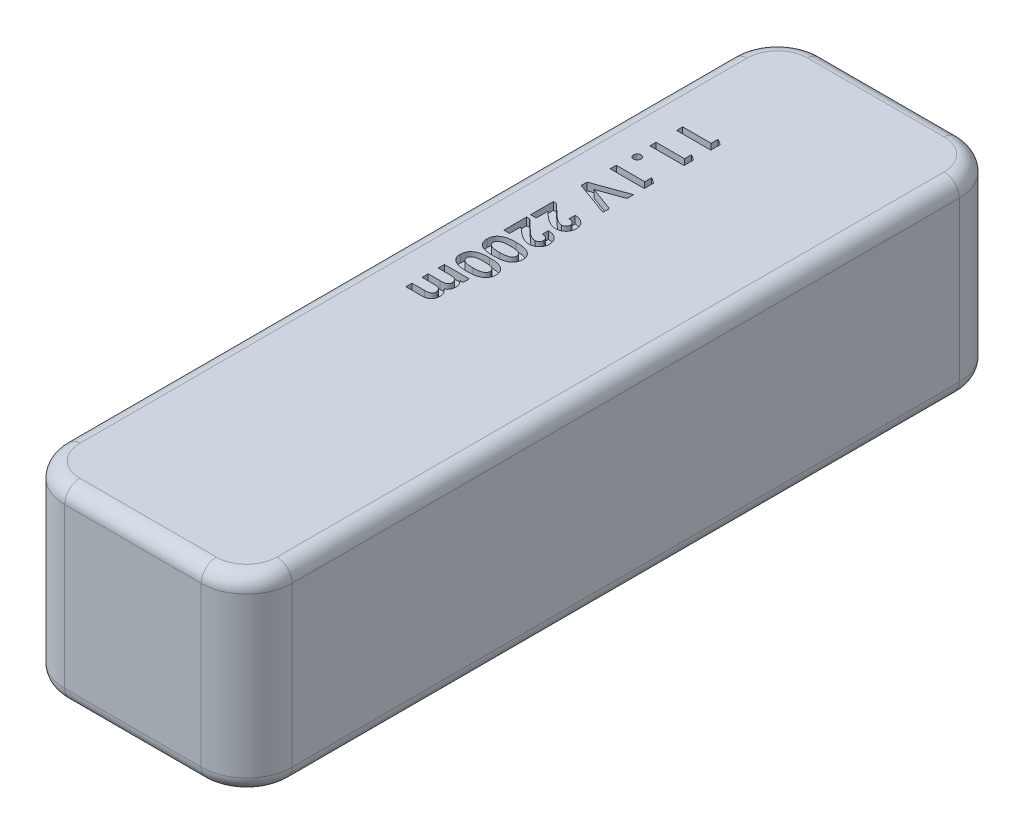
from build123d import *

# Parameters (mm, degrees)
SKETCH_1_W          = 30
SKETCH_1_H          = 100
EXTRUDE_1_DEPTH     = 25
FILLET_2_R          = 6
FILLET_3_R          = 2
CUT_EXTRUDE_1_DEPTH = 1


with BuildPart() as part:
    # 草圖1 → 填料-伸長1 (new body)
    with BuildSketch(Plane(origin=(0, 0, 0), x_dir=(1, 0, 0), z_dir=(0, 1, 0))):
        Rectangle(SKETCH_1_W, SKETCH_1_H)
    extrude(amount=EXTRUDE_1_DEPTH)

    # 圓角2
    fillet_2_edges = [part.edges().sort_by_distance(p)[0] for p in [
        (15, 12.5, 50),
        (-15, 12.5, 50),
        (-15, 12.5, -50),
        (15, 12.5, -50),
    ]]
    fillet(fillet_2_edges, radius=FILLET_2_R)

    # 圓角3
    fillet_3_edges = [part.edges().sort_by_distance(p)[0] for p in [
        (-15, 0, 0),
        (-15, 25, 0),
        (15, 0, 0),
        (0, 0, 50),
        (0, 0, -50),
        (13.242640687, 0, 48.242640687),
        (-13.242640687, 0, 48.242640687),
        (13.242640687, 0, -48.242640687),
        (-13.242640687, 0, -48.242640687),
        (0, 25, -50),
        (15, 25, 0),
        (0, 25, 50),
        (13.242640687, 25, 48.242640687),
        (-13.242640687, 25, 48.242640687),
        (13.242640687, 25, -48.242640687),
        (-13.242640687, 25, -48.242640687),
    ]]
    fillet(fillet_3_edges, radius=FILLET_3_R)

    # 草圖2 → 除料-伸長1 (cut)
    # profile 1 of 10: a face of its own
    with BuildSketch(Plane(origin=(0, 25, 0), x_dir=(1, 0, 0), z_dir=(0, 1, 0))):
        Polygon((-4.881593101, 32.34579671), (-4.881593101, 31.097299114), (-9.381593101, 31.097299114), (-9.381593101, 31.904991422), (-5.631593101, 31.904991422), (-5.631593101, 32.828068345), align=None)
    # profile 2 of 10: a face of its own
    with BuildSketch(Plane(origin=(0, 25, 0), x_dir=(1, 0, 0), z_dir=(0, 1, 0))):
        Polygon((-4.881593101, 28.826565941), (-4.881593101, 27.578068345), (-9.381593101, 27.578068345), (-9.381593101, 28.385760652), (-5.631593101, 28.385760652), (-5.631593101, 29.308837576), align=None)
    # profile 3 of 10: a face of its own
    with BuildSketch(Plane(origin=(0, 25, 0), x_dir=(1, 0, 0), z_dir=(0, 1, 0))):
        with BuildLine():
            add(Edge.make_bspline(
                [(-8.458516178, 25.472299114), (-8.460290027, 25.439685763), (-8.463782428, 25.375475708), (-8.490321002, 25.282578442), (-8.536972452, 25.198249578), (-8.598912112, 25.123381261), (-8.672626709, 25.059811488), (-8.757618272, 25.015358455), (-8.849706295, 24.986603997), (-8.914126505, 24.983502103), (-8.947097909, 24.981914499)],
                knots=[0, 0, 0, 0, 1.016476041, 2.001265769, 2.982571086, 4.001334304, 5.018889842, 5.99575474, 6.974191785, 8, 8, 8, 8], degree=3))
            add(Edge.make_bspline(
                [(-8.947097909, 24.981914499), (-8.980074401, 24.983491697), (-9.044504551, 24.986573261), (-9.136776315, 25.015555014), (-9.222457473, 25.059740673), (-9.296967241, 25.123386569), (-9.360069217, 25.197938011), (-9.406279845, 25.282771986), (-9.434311369, 25.375299105), (-9.437611444, 25.4396547), (-9.439285409, 25.472299114)],
                knots=[0, 0, 0, 0, 1.022731703, 1.998234309, 2.980426153, 4.002090265, 5.023754376, 6.00211665, 6.986572482, 8, 8, 8, 8], degree=3))
            add(Edge.make_bspline(
                [(-9.439285409, 25.472299114), (-9.43759772, 25.504935795), (-9.43427059, 25.569276144), (-9.406513808, 25.66165966), (-9.359757051, 25.745871914), (-9.297043312, 25.82040463), (-9.222192419, 25.883767449), (-9.137044971, 25.929246108), (-9.044469649, 25.957960396), (-8.980062585, 25.96108467), (-8.947097909, 25.962683729)],
                knots=[0, 0, 0, 0, 1.013910294, 1.9988351, 2.969460266, 3.991611077, 5.013761889, 6.000813773, 6.976781088, 8, 8, 8, 8], degree=3))
            add(Edge.make_bspline(
                [(-8.947097909, 25.962683729), (-8.914138526, 25.961074126), (-8.849741804, 25.957929249), (-8.757346522, 25.929443228), (-8.672893202, 25.883699093), (-8.598835882, 25.820409708), (-8.537282181, 25.745561944), (-8.490090245, 25.661852124), (-8.463823508, 25.569099452), (-8.460303864, 25.504904695), (-8.458516178, 25.472299114)],
                knots=[0, 0, 0, 0, 1.02629359, 2.005193596, 2.986963232, 4.00500024, 5.0242455, 5.997787305, 6.983042999, 8, 8, 8, 8], degree=3))
        make_face()
    # profile 4 of 10: a face of its own
    with BuildSketch(Plane(origin=(0, 25, 0), x_dir=(1, 0, 0), z_dir=(0, 1, 0))):
        Polygon((-4.881593101, 23.576565941), (-4.881593101, 22.328068345), (-9.381593101, 22.328068345), (-9.381593101, 23.135760652), (-5.631593101, 23.135760652), (-5.631593101, 24.058837576), align=None)
    # profile 5 of 10: a face of its own
    with BuildSketch(Plane(origin=(0, 25, 0), x_dir=(1, 0, 0), z_dir=(0, 1, 0))):
        Polygon((-4.881593101, 20.914606806), (-4.881593101, 20.051926518), (-8.078107524, 18.895376037), (-4.881593101, 17.736121229), (-4.881593101, 16.876145268), (-9.381593101, 18.507755845), (-9.381593101, 19.285700556), align=None)
    # profile 6 of 10: a face of its own
    with BuildSketch(Plane(origin=(0, 25, 0), x_dir=(1, 0, 0), z_dir=(0, 1, 0))):
        with BuildLine():
            Line((-6.381593101, 13.904991422), (-6.381593101, 14.712683729))
            add(Edge.make_bspline(
                [(-6.381593101, 14.712683729), (-6.320495451, 14.70919543), (-6.201114311, 14.702379503), (-6.027709383, 14.675267467), (-5.863860794, 14.63893827), (-5.710141705, 14.590452133), (-5.566607972, 14.52952613), (-5.432770281, 14.457728043), (-5.30933329, 14.373223595), (-5.196892282, 14.277811317), (-5.096020417, 14.173111049), (-5.006581084, 14.06129647), (-4.932777997, 13.940657226), (-4.872044889, 13.813397494), (-4.823521959, 13.679538944), (-4.791080453, 13.537815065), (-4.769110747, 13.389452977), (-4.76718831, 13.287887114), (-4.766208486, 13.236121229)],
                knots=[0, 0, 0, 0, 1.199038563, 2.342849363, 3.436047546, 4.486744587, 5.497670872, 6.488682221, 7.459191391, 8.424610317, 9.374430501, 10.305433194, 11.225809216, 12.140057399, 13.06607119, 14.010487599, 14.985989317, 16, 16, 16, 16], degree=3))
            add(Edge.make_bspline(
                [(-4.766208486, 13.236121229), (-4.76819439, 13.172580735), (-4.77207134, 13.048534799), (-4.80504415, 12.868262788), (-4.860519644, 12.699740487), (-4.937259728, 12.542962684), (-5.035201605, 12.399811349), (-5.15300391, 12.271218998), (-5.290256632, 12.15798881), (-5.44416051, 12.062288064), (-5.607379676, 11.984072773), (-5.775467911, 11.928138853), (-5.944922424, 11.891617718), (-6.058997159, 11.887704617), (-6.11566762, 11.885760652)],
                knots=[0, 0, 0, 0, 1.075208937, 2.099059817, 3.090102131, 4.070747506, 5.044426497, 6.016695572, 7.013986309, 8.047248753, 9.078128699, 10.07077592, 11.041593041, 12, 12, 12, 12], degree=3))
            add(Edge.make_bspline(
                [(-6.11566762, 11.885760652), (-6.14994726, 11.886515621), (-6.218943707, 11.888035187), (-6.323352265, 11.898600932), (-6.429704592, 11.914451631), (-6.537909481, 11.938350648), (-6.647997344, 11.968154583), (-6.760297318, 12.004311449), (-6.874173953, 12.04765811), (-6.990903983, 12.097478354), (-7.110886145, 12.156890061), (-7.235837508, 12.226165322), (-7.366126301, 12.306739509), (-7.500800447, 12.39948731), (-7.642779059, 12.50064453), (-7.788406695, 12.615008733), (-7.940068492, 12.739232191), (-8.041380519, 12.827493552), (-8.093432043, 12.872839979)],
                knots=[0, 0, 0, 0, 0.728291422, 1.465870735, 2.227967504, 3.011895603, 3.818808047, 4.650669213, 5.517493715, 6.406970765, 7.346374078, 8.360901659, 9.441709605, 10.599840149, 11.834858619, 13.145178554, 14.533265854, 16, 16, 16, 16], degree=3))
            Line((-8.093432043, 12.872839979), (-8.631593101, 13.342491422))
            Line((-8.631593101, 13.342491422), (-8.631593101, 11.828068345))
            Line((-8.631593101, 11.828068345), (-9.381593101, 11.828068345))
            Line((-9.381593101, 11.828068345), (-9.381593101, 14.828068345))
            Line((-9.381593101, 14.828068345), (-8.972338293, 14.828068345))
            Line((-8.972338293, 14.828068345), (-7.554369543, 13.495736614))
            add(Edge.make_bspline(
                [(-7.554369543, 13.495736614), (-7.513006955, 13.457162187), (-7.432899887, 13.38245496), (-7.315254135, 13.276154276), (-7.203611124, 13.179961547), (-7.096782082, 13.095871407), (-6.998232109, 13.019470915), (-6.904990784, 12.954166762), (-6.817901043, 12.899361466), (-6.712886026, 12.839862544), (-6.58763693, 12.783358127), (-6.443344837, 12.731511905), (-6.305434827, 12.699908044), (-6.2155697, 12.695545712), (-6.172458486, 12.69345296)],
                knots=[0, 0, 0, 0, 1.246127091, 2.413378631, 3.493388633, 4.492180848, 5.408488754, 6.240484944, 6.999099869, 7.674939598, 8.898438119, 10.020720584, 11.050475521, 12, 12, 12, 12], degree=3))
            add(Edge.make_bspline(
                [(-6.172458486, 12.69345296), (-6.130739304, 12.694993227), (-6.0499017, 12.697977741), (-5.935245184, 12.73159265), (-5.830647635, 12.78188886), (-5.740873761, 12.85490942), (-5.66645957, 12.943043369), (-5.611929749, 13.045469663), (-5.579879988, 13.160307676), (-5.575931848, 13.240725287), (-5.573900793, 13.282094787)],
                knots=[0, 0, 0, 0, 1.061596218, 2.057012874, 3.024113775, 4.006148568, 4.986025304, 5.949989669, 6.945406325, 8, 8, 8, 8], degree=3))
            add(Edge.make_bspline(
                [(-5.573900793, 13.282094787), (-5.574656562, 13.303462583), (-5.576144413, 13.345528521), (-5.586048637, 13.407362162), (-5.603503797, 13.466201314), (-5.626891255, 13.522700889), (-5.657891498, 13.57625791), (-5.696104237, 13.626737287), (-5.740558399, 13.674670886), (-5.791114982, 13.719838863), (-5.847536143, 13.760947619), (-5.909306591, 13.797460265), (-5.976387983, 13.827650145), (-6.047894741, 13.854230413), (-6.124594908, 13.874730388), (-6.20602944, 13.889656912), (-6.292065855, 13.901004552), (-6.351207799, 13.903638289), (-6.381593101, 13.904991422)],
                knots=[0, 0, 0, 0, 0.903469896, 1.778625579, 2.63899355, 3.493148037, 4.358286772, 5.247621495, 6.164656832, 7.118446693, 8.109501108, 9.111810964, 10.146451449, 11.215617525, 12.33435995, 13.498009769, 14.714554818, 16, 16, 16, 16], degree=3))
        make_face()
    # profile 7 of 10: a face of its own
    with BuildSketch(Plane(origin=(0, 25, 0), x_dir=(1, 0, 0), z_dir=(0, 1, 0))):
        with BuildLine():
            Line((-6.381593101, 10.385760652), (-6.381593101, 11.19345296))
            add(Edge.make_bspline(
                [(-6.381593101, 11.19345296), (-6.320495451, 11.189964661), (-6.201114311, 11.183148734), (-6.027709383, 11.156036698), (-5.863860794, 11.119707501), (-5.710141705, 11.071221364), (-5.566607972, 11.010295361), (-5.432770281, 10.938497274), (-5.30933329, 10.853992825), (-5.196892282, 10.758580548), (-5.096020417, 10.65388028), (-5.006581084, 10.542065701), (-4.932777997, 10.421426457), (-4.872044889, 10.294166725), (-4.823521959, 10.160308175), (-4.791080453, 10.018584296), (-4.769110747, 9.870222208), (-4.76718831, 9.768656345), (-4.766208486, 9.71689046)],
                knots=[0, 0, 0, 0, 1.199038563, 2.342849363, 3.436047546, 4.486744587, 5.497670872, 6.488682221, 7.459191391, 8.424610317, 9.374430501, 10.305433194, 11.225809216, 12.140057399, 13.06607119, 14.010487599, 14.985989317, 16, 16, 16, 16], degree=3))
            add(Edge.make_bspline(
                [(-4.766208486, 9.71689046), (-4.76819439, 9.653349966), (-4.77207134, 9.52930403), (-4.80504415, 9.349032019), (-4.860519644, 9.180509718), (-4.937259728, 9.023731915), (-5.035201605, 8.880580579), (-5.15300391, 8.751988228), (-5.290256632, 8.638758041), (-5.44416051, 8.543057295), (-5.607379676, 8.464842003), (-5.775467911, 8.408908084), (-5.944922424, 8.372386949), (-6.058997159, 8.368473848), (-6.11566762, 8.366529883)],
                knots=[0, 0, 0, 0, 1.075208937, 2.099059817, 3.090102131, 4.070747506, 5.044426497, 6.016695572, 7.013986309, 8.047248753, 9.078128699, 10.07077592, 11.041593041, 12, 12, 12, 12], degree=3))
            add(Edge.make_bspline(
                [(-6.11566762, 8.366529883), (-6.14994726, 8.367284852), (-6.218943707, 8.368804418), (-6.323352265, 8.379370163), (-6.429704592, 8.395220861), (-6.537909481, 8.419119879), (-6.647997344, 8.448923814), (-6.760297318, 8.48508068), (-6.874173953, 8.528427341), (-6.990903983, 8.578247585), (-7.110886145, 8.637659292), (-7.235837508, 8.706934552), (-7.366126301, 8.787508739), (-7.500800447, 8.880256541), (-7.642779059, 8.981413761), (-7.788406695, 9.095777963), (-7.940068492, 9.220001421), (-8.041380519, 9.308262783), (-8.093432043, 9.35360921)],
                knots=[0, 0, 0, 0, 0.728291422, 1.465870735, 2.227967504, 3.011895603, 3.818808047, 4.650669213, 5.517493715, 6.406970765, 7.346374078, 8.360901659, 9.441709605, 10.599840149, 11.834858619, 13.145178554, 14.533265854, 16, 16, 16, 16], degree=3))
            Line((-8.093432043, 9.35360921), (-8.631593101, 9.823260652))
            Line((-8.631593101, 9.823260652), (-8.631593101, 8.308837576))
            Line((-8.631593101, 8.308837576), (-9.381593101, 8.308837576))
            Line((-9.381593101, 8.308837576), (-9.381593101, 11.308837576))
            Line((-9.381593101, 11.308837576), (-8.972338293, 11.308837576))
            Line((-8.972338293, 11.308837576), (-7.554369543, 9.976505845))
            add(Edge.make_bspline(
                [(-7.554369543, 9.976505845), (-7.513006955, 9.937931417), (-7.432899887, 9.863224191), (-7.315254135, 9.756923507), (-7.203611124, 9.660730777), (-7.096782082, 9.576640638), (-6.998232109, 9.500240145), (-6.904990784, 9.434935992), (-6.817901043, 9.380130697), (-6.712886026, 9.320631775), (-6.58763693, 9.264127358), (-6.443344837, 9.212281136), (-6.305434827, 9.180677275), (-6.2155697, 9.176314943), (-6.172458486, 9.174222191)],
                knots=[0, 0, 0, 0, 1.246127091, 2.413378631, 3.493388633, 4.492180848, 5.408488754, 6.240484944, 6.999099869, 7.674939598, 8.898438119, 10.020720584, 11.050475521, 12, 12, 12, 12], degree=3))
            add(Edge.make_bspline(
                [(-6.172458486, 9.174222191), (-6.130739304, 9.175762458), (-6.0499017, 9.178746972), (-5.935245184, 9.212361881), (-5.830647635, 9.26265809), (-5.740873761, 9.335678651), (-5.66645957, 9.4238126), (-5.611929749, 9.526238894), (-5.579879988, 9.641076907), (-5.575931848, 9.721494517), (-5.573900793, 9.762864018)],
                knots=[0, 0, 0, 0, 1.061596218, 2.057012874, 3.024113775, 4.006148568, 4.986025304, 5.949989669, 6.945406325, 8, 8, 8, 8], degree=3))
            add(Edge.make_bspline(
                [(-5.573900793, 9.762864018), (-5.574656562, 9.784231814), (-5.576144413, 9.826297752), (-5.586048637, 9.888131393), (-5.603503797, 9.946970545), (-5.626891255, 10.00347012), (-5.657891498, 10.05702714), (-5.696104237, 10.107506518), (-5.740558399, 10.155440116), (-5.791114982, 10.200608094), (-5.847536143, 10.241716849), (-5.909306591, 10.278229496), (-5.976387983, 10.308419376), (-6.047894741, 10.334999644), (-6.124594908, 10.355499618), (-6.20602944, 10.370426143), (-6.292065855, 10.381773783), (-6.351207799, 10.38440752), (-6.381593101, 10.385760652)],
                knots=[0, 0, 0, 0, 0.903469896, 1.778625579, 2.63899355, 3.493148037, 4.358286772, 5.247621495, 6.164656832, 7.118446693, 8.109501108, 9.111810964, 10.146451449, 11.215617525, 12.33435995, 13.498009769, 14.714554818, 16, 16, 16, 16], degree=3))
        make_face()
    # profile 8 of 10: a face of its own
    with BuildSketch(Plane(origin=(0, 25, 0), x_dir=(1, 0, 0), z_dir=(0, 1, 0))):
        with BuildLine():
            add(Edge.make_bspline(
                [(-4.766208486, 6.216589979), (-4.766788798, 6.177494279), (-4.767929846, 6.100621687), (-4.780290965, 5.987403518), (-4.798959704, 5.87834047), (-4.825015449, 5.773018224), (-4.859429757, 5.672150026), (-4.900975384, 5.574922557), (-4.950645655, 5.482153472), (-5.007720131, 5.393628179), (-5.071551312, 5.308934387), (-5.145334331, 5.230889691), (-5.225800908, 5.156473256), (-5.314279279, 5.086919023), (-5.41137252, 5.023005723), (-5.515794379, 4.963540277), (-5.62852776, 4.909289522), (-5.749687562, 4.859535777), (-5.881110174, 4.815026235), (-6.024317747, 4.777641755), (-6.179207628, 4.745140774), (-6.346586743, 4.719545338), (-6.526060261, 4.698596079), (-6.717964021, 4.684908066), (-6.921760986, 4.67538574), (-7.061569052, 4.674617089), (-7.133395986, 4.674222191)],
                knots=[0, 0, 0, 0, 0.879087513, 1.728520926, 2.558587148, 3.366762743, 4.166157112, 4.95337177, 5.74258602, 6.530032775, 7.320866164, 8.124307838, 8.942260106, 9.784645725, 10.652593514, 11.554662219, 12.485739241, 13.464770064, 14.499274465, 15.604285219, 16.792026686, 18.057713884, 19.411711354, 20.855437135, 22.384468668, 24, 24, 24, 24], degree=3))
            add(Edge.make_bspline(
                [(-7.133395986, 4.674222191), (-7.20612111, 4.674651959), (-7.347424721, 4.67548699), (-7.553091826, 4.684483926), (-7.746367691, 4.699976951), (-7.927232053, 4.719945864), (-8.095590307, 4.747296495), (-8.251875317, 4.779332154), (-8.396040809, 4.817386426), (-8.527727037, 4.863377394), (-8.649174119, 4.912706543), (-8.761294888, 4.967487721), (-8.866103642, 5.024424623), (-8.962139777, 5.086968697), (-9.049614423, 5.153790716), (-9.129331214, 5.223841642), (-9.200192493, 5.298614165), (-9.263661596, 5.376990059), (-9.319217966, 5.460873825), (-9.366948483, 5.549896484), (-9.40639327, 5.644658731), (-9.440392244, 5.74378201), (-9.464852859, 5.849029706), (-9.484245569, 5.95877676), (-9.494966643, 6.074248874), (-9.496296357, 6.152867459), (-9.496977717, 6.193152479)],
                knots=[0, 0, 0, 0, 1.643682949, 3.193646483, 4.651618242, 6.025629174, 7.305184366, 8.505292942, 9.630500342, 10.672179876, 11.655924581, 12.591484594, 13.491256898, 14.350247848, 15.17884557, 15.977481787, 16.746098769, 17.504475725, 18.254166354, 19.016819136, 19.783753977, 20.571954997, 21.382401421, 22.223156612, 23.089526058, 24, 24, 24, 24], degree=3))
            add(Edge.make_bspline(
                [(-9.496977717, 6.193152479), (-9.496280281, 6.233435621), (-9.494914015, 6.312349702), (-9.4843578, 6.428145196), (-9.464607146, 6.538721675), (-9.440547467, 6.644948852), (-9.406209942, 6.745893816), (-9.36613199, 6.842294027), (-9.318128857, 6.93366956), (-9.262818973, 7.020077981), (-9.199380482, 7.101206384), (-9.128507032, 7.178320291), (-9.050374158, 7.251247813), (-8.964107846, 7.318879941), (-8.870859236, 7.382324031), (-8.769563656, 7.440919127), (-8.660368182, 7.494627471), (-8.543122149, 7.545139221), (-8.41529514, 7.588995527), (-8.275771369, 7.628158662), (-8.123233913, 7.659702223), (-7.958255942, 7.687331603), (-7.780259309, 7.705882988), (-7.590065086, 7.721749042), (-7.387086369, 7.730626224), (-7.247586564, 7.731476649), (-7.175763774, 7.731914499)],
                knots=[0, 0, 0, 0, 0.917197984, 1.796777363, 2.643741708, 3.473481078, 4.273990801, 5.068160217, 5.848535553, 6.620952589, 7.401027954, 8.190319769, 9.003592045, 9.831693788, 10.683727512, 11.569696396, 12.49373307, 13.453184301, 14.474457586, 15.568383184, 16.750575061, 18.019320986, 19.375517054, 20.823796471, 22.364701649, 24, 24, 24, 24], degree=3))
            add(Edge.make_bspline(
                [(-7.175763774, 7.731914499), (-7.075971932, 7.731130909), (-6.883422288, 7.729618963), (-6.605204796, 7.710949723), (-6.348231505, 7.682708242), (-6.112191918, 7.644047824), (-5.897548039, 7.591976454), (-5.704361524, 7.528073607), (-5.530720073, 7.454749373), (-5.427837169, 7.392367054), (-5.378287813, 7.362323152)],
                knots=[0, 0, 0, 0, 1.288526675, 2.486228817, 3.599112392, 4.626206381, 5.5730174, 6.447949553, 7.252518174, 8, 8, 8, 8], degree=3))
            add(Edge.make_bspline(
                [(-5.378287813, 7.362323152), (-5.329611889, 7.327382553), (-5.234440868, 7.259066796), (-5.109499106, 7.139614784), (-5.002642794, 7.011279151), (-4.916290184, 6.871423954), (-4.848192509, 6.722261062), (-4.800095888, 6.562509836), (-4.772072555, 6.392760211), (-4.768192365, 6.276190311), (-4.766208486, 6.216589979)],
                knots=[0, 0, 0, 0, 1.058512271, 2.069600068, 3.047294572, 4.004278952, 4.967380941, 5.939006123, 6.946246673, 8, 8, 8, 8], degree=3))
        make_face()
        with BuildLine():
            add(Edge.make_bspline(
                [(-5.573900793, 6.196758249), (-5.575588814, 6.232094538), (-5.57889823, 6.301372422), (-5.606519859, 6.401744975), (-5.650111083, 6.495968069), (-5.701492553, 6.568095182), (-5.751621328, 6.621838244), (-5.795593533, 6.660789224), (-5.847022527, 6.695673803), (-5.903685322, 6.729332622), (-5.967141319, 6.759279949), (-6.035790001, 6.789058029), (-6.111923222, 6.81331859), (-6.194106136, 6.837211537), (-6.284655676, 6.858100135), (-6.384283959, 6.87573258), (-6.493740138, 6.890937462), (-6.612758879, 6.90377619), (-6.741814048, 6.911938778), (-6.880605172, 6.919838061), (-7.029419481, 6.922713696), (-7.131893992, 6.923708698), (-7.184778197, 6.924222191)],
                knots=[0, 0, 0, 0, 1.076821401, 2.111141558, 3.153197101, 4.23200803, 4.796476379, 5.394298193, 6.020090776, 6.690078086, 7.403703365, 8.159894791, 8.971856079, 9.83973388, 10.771758647, 11.806038152, 12.926526118, 14.143777411, 15.458313878, 16.872423957, 18.385946227, 20, 20, 20, 20], degree=3))
            add(Edge.make_bspline(
                [(-7.184778197, 6.924222191), (-7.253294021, 6.923399751), (-7.384678194, 6.921822662), (-7.573606305, 6.913530856), (-7.745570261, 6.897006449), (-7.901630306, 6.876185387), (-8.041194281, 6.84782165), (-8.16430551, 6.812504718), (-8.271875454, 6.77334037), (-8.362322179, 6.724235693), (-8.439672693, 6.671624334), (-8.506584755, 6.615470002), (-8.562323316, 6.554793308), (-8.609644243, 6.49140791), (-8.644782799, 6.422963205), (-8.670399938, 6.350862677), (-8.686019315, 6.274946272), (-8.688190417, 6.222971586), (-8.689285409, 6.196758249)],
                knots=[0, 0, 0, 0, 1.772047989, 3.398033405, 4.888860297, 6.238411839, 7.468309579, 8.567754056, 9.549141588, 10.421774021, 11.221426488, 11.965694757, 12.675067502, 13.348095901, 14.005005053, 14.656328889, 15.322321954, 16, 16, 16, 16], degree=3))
            add(Edge.make_bspline(
                [(-8.689285409, 6.196758249), (-8.688537023, 6.171443494), (-8.687071776, 6.121880353), (-8.672031213, 6.049606193), (-8.647578524, 5.981258612), (-8.612988479, 5.917043972), (-8.569001944, 5.856732587), (-8.515425624, 5.800619221), (-8.451725488, 5.74912707), (-8.404450566, 5.71912751), (-8.380090697, 5.703669306)],
                knots=[0, 0, 0, 0, 0.992283464, 1.942767638, 2.88273346, 3.832339453, 4.79467288, 5.803907806, 6.868395428, 8, 8, 8, 8], degree=3))
            add(Edge.make_bspline(
                [(-8.380090697, 5.703669306), (-8.346804828, 5.685464255), (-8.277007059, 5.647289739), (-8.159202507, 5.603226153), (-8.026505781, 5.565636537), (-7.87784395, 5.53550368), (-7.713813514, 5.511636434), (-7.534292561, 5.49338992), (-7.339023767, 5.484121902), (-7.203716803, 5.482669389), (-7.133395986, 5.481914499)],
                knots=[0, 0, 0, 0, 0.710996797, 1.490902623, 2.352723643, 3.296875318, 4.334065587, 5.461510359, 6.680713396, 8, 8, 8, 8], degree=3))
            add(Edge.make_bspline(
                [(-7.133395986, 5.481914499), (-7.062466932, 5.4822113), (-6.925940611, 5.482782592), (-6.729941025, 5.49326416), (-6.550927906, 5.507860522), (-6.389301033, 5.529210858), (-6.244667668, 5.556681724), (-6.117038479, 5.59054037), (-6.006158101, 5.630455014), (-5.912149139, 5.677795889), (-5.832226133, 5.730207229), (-5.763753097, 5.78591484), (-5.704803154, 5.845015057), (-5.657021722, 5.908144656), (-5.618938702, 5.974882344), (-5.592985931, 6.045588198), (-5.577020658, 6.120027007), (-5.574954785, 6.170835942), (-5.573900793, 6.196758249)],
                knots=[0, 0, 0, 0, 1.793903324, 3.452957663, 4.963427329, 6.336122014, 7.574844885, 8.684777121, 9.673127442, 10.55010789, 11.340650774, 12.086136756, 12.779466299, 13.446812155, 14.083183996, 14.715685896, 15.34475337, 16, 16, 16, 16], degree=3))
        make_face(mode=Mode.SUBTRACT)
    # profile 9 of 10: a face of its own
    with BuildSketch(Plane(origin=(0, 25, 0), x_dir=(1, 0, 0), z_dir=(0, 1, 0))):
        with BuildLine():
            add(Edge.make_bspline(
                [(-4.766208486, 2.69735921), (-4.766788798, 2.65826351), (-4.767929846, 2.581390918), (-4.780290965, 2.468172749), (-4.798959704, 2.359109701), (-4.825015449, 2.253787454), (-4.859429757, 2.152919257), (-4.900975384, 2.055691788), (-4.950645655, 1.962922703), (-5.007720131, 1.87439741), (-5.071551312, 1.789703618), (-5.145334331, 1.711658922), (-5.225800908, 1.637242486), (-5.314279279, 1.567688254), (-5.41137252, 1.503774953), (-5.515794379, 1.444309508), (-5.62852776, 1.390058753), (-5.749687562, 1.340305007), (-5.881110174, 1.295795466), (-6.024317747, 1.258410985), (-6.179207628, 1.225910005), (-6.346586743, 1.200314569), (-6.526060261, 1.17936531), (-6.717964021, 1.165677296), (-6.921760986, 1.156154971), (-7.061569052, 1.155386319), (-7.133395986, 1.154991422)],
                knots=[0, 0, 0, 0, 0.879087513, 1.728520926, 2.558587148, 3.366762743, 4.166157112, 4.95337177, 5.74258602, 6.530032775, 7.320866164, 8.124307838, 8.942260106, 9.784645725, 10.652593514, 11.554662219, 12.485739241, 13.464770064, 14.499274465, 15.604285219, 16.792026686, 18.057713884, 19.411711354, 20.855437135, 22.384468668, 24, 24, 24, 24], degree=3))
            add(Edge.make_bspline(
                [(-7.133395986, 1.154991422), (-7.20612111, 1.15542119), (-7.347424721, 1.156256221), (-7.553091826, 1.165253157), (-7.746367691, 1.180746182), (-7.927232053, 1.200715095), (-8.095590307, 1.228065725), (-8.251875317, 1.260101385), (-8.396040809, 1.298155657), (-8.527727037, 1.344146624), (-8.649174119, 1.393475773), (-8.761294888, 1.448256952), (-8.866103642, 1.505193854), (-8.962139777, 1.567737928), (-9.049614423, 1.634559947), (-9.129331214, 1.704610873), (-9.200192493, 1.779383396), (-9.263661596, 1.85775929), (-9.319217966, 1.941643056), (-9.366948483, 2.030665715), (-9.40639327, 2.125427962), (-9.440392244, 2.224551241), (-9.464852859, 2.329798937), (-9.484245569, 2.439545991), (-9.494966643, 2.555018105), (-9.496296357, 2.633636689), (-9.496977717, 2.67392171)],
                knots=[0, 0, 0, 0, 1.643682949, 3.193646483, 4.651618242, 6.025629174, 7.305184366, 8.505292942, 9.630500342, 10.672179876, 11.655924581, 12.591484594, 13.491256898, 14.350247848, 15.17884557, 15.977481787, 16.746098769, 17.504475725, 18.254166354, 19.016819136, 19.783753977, 20.571954997, 21.382401421, 22.223156612, 23.089526058, 24, 24, 24, 24], degree=3))
            add(Edge.make_bspline(
                [(-9.496977717, 2.67392171), (-9.496280281, 2.714204851), (-9.494914015, 2.793118933), (-9.4843578, 2.908914427), (-9.464607146, 3.019490906), (-9.440547467, 3.125718083), (-9.406209942, 3.226663047), (-9.36613199, 3.323063257), (-9.318128857, 3.414438791), (-9.262818973, 3.500847212), (-9.199380482, 3.581975615), (-9.128507032, 3.659089522), (-9.050374158, 3.732017044), (-8.964107846, 3.799649172), (-8.870859236, 3.863093262), (-8.769563656, 3.921688358), (-8.660368182, 3.975396701), (-8.543122149, 4.025908452), (-8.41529514, 4.069764758), (-8.275771369, 4.108927893), (-8.123233913, 4.140471453), (-7.958255942, 4.168100834), (-7.780259309, 4.186652219), (-7.590065086, 4.202518272), (-7.387086369, 4.211395455), (-7.247586564, 4.21224588), (-7.175763774, 4.212683729)],
                knots=[0, 0, 0, 0, 0.917197984, 1.796777363, 2.643741708, 3.473481078, 4.273990801, 5.068160217, 5.848535553, 6.620952589, 7.401027954, 8.190319769, 9.003592045, 9.831693788, 10.683727512, 11.569696396, 12.49373307, 13.453184301, 14.474457586, 15.568383184, 16.750575061, 18.019320986, 19.375517054, 20.823796471, 22.364701649, 24, 24, 24, 24], degree=3))
            add(Edge.make_bspline(
                [(-7.175763774, 4.212683729), (-7.075971932, 4.21190014), (-6.883422288, 4.210388194), (-6.605204796, 4.191718954), (-6.348231505, 4.163477473), (-6.112191918, 4.124817055), (-5.897548039, 4.072745685), (-5.704361524, 4.008842838), (-5.530720073, 3.935518604), (-5.427837169, 3.873136284), (-5.378287813, 3.843092383)],
                knots=[0, 0, 0, 0, 1.288526675, 2.486228817, 3.599112392, 4.626206381, 5.5730174, 6.447949553, 7.252518174, 8, 8, 8, 8], degree=3))
            add(Edge.make_bspline(
                [(-5.378287813, 3.843092383), (-5.329611889, 3.808151784), (-5.234440868, 3.739836026), (-5.109499106, 3.620384015), (-5.002642794, 3.492048382), (-4.916290184, 3.352193185), (-4.848192509, 3.203030293), (-4.800095888, 3.043279067), (-4.772072555, 2.873529442), (-4.768192365, 2.756959542), (-4.766208486, 2.69735921)],
                knots=[0, 0, 0, 0, 1.058512271, 2.069600068, 3.047294572, 4.004278952, 4.967380941, 5.939006123, 6.946246673, 8, 8, 8, 8], degree=3))
        make_face()
        with BuildLine():
            add(Edge.make_bspline(
                [(-5.573900793, 2.677527479), (-5.575588814, 2.712863768), (-5.57889823, 2.782141652), (-5.606519859, 2.882514205), (-5.650111083, 2.9767373), (-5.701492553, 3.048864413), (-5.751621328, 3.102607475), (-5.795593533, 3.141558455), (-5.847022527, 3.176443033), (-5.903685322, 3.210101852), (-5.967141319, 3.24004918), (-6.035790001, 3.269827259), (-6.111923222, 3.294087821), (-6.194106136, 3.317980767), (-6.284655676, 3.338869366), (-6.384283959, 3.35650181), (-6.493740138, 3.371706692), (-6.612758879, 3.384545421), (-6.741814048, 3.392708008), (-6.880605172, 3.400607292), (-7.029419481, 3.403482927), (-7.131893992, 3.404477929), (-7.184778197, 3.404991422)],
                knots=[0, 0, 0, 0, 1.076821401, 2.111141558, 3.153197101, 4.23200803, 4.796476379, 5.394298193, 6.020090776, 6.690078086, 7.403703365, 8.159894791, 8.971856079, 9.83973388, 10.771758647, 11.806038152, 12.926526118, 14.143777411, 15.458313878, 16.872423957, 18.385946227, 20, 20, 20, 20], degree=3))
            add(Edge.make_bspline(
                [(-7.184778197, 3.404991422), (-7.253294021, 3.404168982), (-7.384678194, 3.402591893), (-7.573606305, 3.394300086), (-7.745570261, 3.377775679), (-7.901630306, 3.356954618), (-8.041194281, 3.328590881), (-8.16430551, 3.293273949), (-8.271875454, 3.2541096), (-8.362322179, 3.205004924), (-8.439672693, 3.152393565), (-8.506584755, 3.096239233), (-8.562323316, 3.035562539), (-8.609644243, 2.972177141), (-8.644782799, 2.903732436), (-8.670399938, 2.831631908), (-8.686019315, 2.755715502), (-8.688190417, 2.703740816), (-8.689285409, 2.677527479)],
                knots=[0, 0, 0, 0, 1.772047989, 3.398033405, 4.888860297, 6.238411839, 7.468309579, 8.567754056, 9.549141588, 10.421774021, 11.221426488, 11.965694757, 12.675067502, 13.348095901, 14.005005053, 14.656328889, 15.322321954, 16, 16, 16, 16], degree=3))
            add(Edge.make_bspline(
                [(-8.689285409, 2.677527479), (-8.688537023, 2.652212725), (-8.687071776, 2.602649584), (-8.672031213, 2.530375424), (-8.647578524, 2.462027843), (-8.612988479, 2.397813203), (-8.569001944, 2.337501817), (-8.515425624, 2.281388452), (-8.451725488, 2.229896301), (-8.404450566, 2.199896741), (-8.380090697, 2.184438537)],
                knots=[0, 0, 0, 0, 0.992283464, 1.942767638, 2.88273346, 3.832339453, 4.79467288, 5.803907806, 6.868395428, 8, 8, 8, 8], degree=3))
            add(Edge.make_bspline(
                [(-8.380090697, 2.184438537), (-8.346804828, 2.166233486), (-8.277007059, 2.12805897), (-8.159202507, 2.083995383), (-8.026505781, 2.046405768), (-7.87784395, 2.016272911), (-7.713813514, 1.992405665), (-7.534292561, 1.974159151), (-7.339023767, 1.964891132), (-7.203716803, 1.963438619), (-7.133395986, 1.962683729)],
                knots=[0, 0, 0, 0, 0.710996797, 1.490902623, 2.352723643, 3.296875318, 4.334065587, 5.461510359, 6.680713396, 8, 8, 8, 8], degree=3))
            add(Edge.make_bspline(
                [(-7.133395986, 1.962683729), (-7.062466932, 1.962980531), (-6.925940611, 1.963551822), (-6.729941025, 1.97403339), (-6.550927906, 1.988629753), (-6.389301033, 2.009980089), (-6.244667668, 2.037450954), (-6.117038479, 2.0713096), (-6.006158101, 2.111224245), (-5.912149139, 2.15856512), (-5.832226133, 2.210976459), (-5.763753097, 2.266684071), (-5.704803154, 2.325784288), (-5.657021722, 2.388913887), (-5.618938702, 2.455651575), (-5.592985931, 2.526357428), (-5.577020658, 2.600796238), (-5.574954785, 2.651605173), (-5.573900793, 2.677527479)],
                knots=[0, 0, 0, 0, 1.793903324, 3.452957663, 4.963427329, 6.336122014, 7.574844885, 8.684777121, 9.673127442, 10.55010789, 11.340650774, 12.086136756, 12.779466299, 13.446812155, 14.083183996, 14.715685896, 15.34475337, 16, 16, 16, 16], degree=3))
        make_face(mode=Mode.SUBTRACT)
    # profile 10 of 10: a face of its own
    with BuildSketch(Plane(origin=(0, 25, 0), x_dir=(1, 0, 0), z_dir=(0, 1, 0))):
        with BuildLine():
            Line((-6.093131563, 0.462683729), (-6.093131563, -0.345008578))
            Line((-6.093131563, -0.345008578), (-6.486160409, -0.345008578))
            add(Edge.make_bspline(
                [(-6.486160409, -0.345008578), (-6.44991324, -0.380942243), (-6.378545543, -0.451692674), (-6.286433164, -0.56900101), (-6.208484921, -0.691925704), (-6.14488874, -0.820629196), (-6.096018031, -0.955238993), (-6.060669377, -1.09561541), (-6.039658806, -1.242510932), (-6.036861363, -1.342536818), (-6.035439255, -1.393385982)],
                knots=[0, 0, 0, 0, 1.041604913, 2.050834463, 3.038316637, 4.009881179, 4.976705026, 5.957567047, 6.961708705, 8, 8, 8, 8], degree=3))
            add(Edge.make_bspline(
                [(-6.035439255, -1.393385982), (-6.037045268, -1.444298974), (-6.040206653, -1.544519553), (-6.06899098, -1.690782994), (-6.11618488, -1.829434699), (-6.182166111, -1.959220989), (-6.265571711, -2.07966065), (-6.367631562, -2.186994725), (-6.486034959, -2.283592701), (-6.575492889, -2.335110848), (-6.621376755, -2.361535021)],
                knots=[0, 0, 0, 0, 1.023911673, 2.015537006, 2.987151534, 3.96359182, 4.936711095, 5.925066441, 6.935745846, 8, 8, 8, 8], degree=3))
            add(Edge.make_bspline(
                [(-6.621376755, -2.361535021), (-6.575359541, -2.395566707), (-6.485040663, -2.462361358), (-6.367186505, -2.580801024), (-6.264881202, -2.708917501), (-6.182620705, -2.849515454), (-6.115887104, -2.997647015), (-6.069262808, -3.153739334), (-6.040229449, -3.316277992), (-6.037049251, -3.42691734), (-6.035439255, -3.482929251)],
                knots=[0, 0, 0, 0, 1.041229049, 2.043640428, 3.033525965, 4.020091993, 5.002641512, 5.986151007, 6.980475447, 8, 8, 8, 8], degree=3))
            add(Edge.make_bspline(
                [(-6.035439255, -3.482929251), (-6.037170899, -3.540469296), (-6.040560569, -3.653103159), (-6.072142014, -3.816207203), (-6.122560828, -3.969121825), (-6.1940082, -4.108650554), (-6.279864343, -4.234645541), (-6.38086957, -4.341913032), (-6.493932428, -4.430911854), (-6.599491697, -4.488866454), (-6.692821096, -4.526331491), (-6.774034712, -4.548953372), (-6.864720123, -4.570111775), (-6.966096103, -4.585311984), (-7.077209848, -4.599500704), (-7.198800062, -4.607737814), (-7.330457143, -4.613336664), (-7.42154996, -4.613931332), (-7.468732524, -4.614239348)],
                knots=[0, 0, 0, 0, 1.315170088, 2.574427765, 3.785264002, 4.987326231, 6.148597475, 7.262257941, 8.344498924, 9.427503778, 10.004496072, 10.641882744, 11.353963707, 12.133766957, 12.985572148, 13.916147416, 14.920644765, 16, 16, 16, 16], degree=3))
            Line((-7.468732524, -4.614239348), (-9.381593101, -4.614239348))
            Line((-9.381593101, -4.614239348), (-9.381593101, -3.80654704))
            Line((-9.381593101, -3.80654704), (-7.730150793, -3.80654704))
            add(Edge.make_bspline(
                [(-7.730150793, -3.80654704), (-7.685977651, -3.80587508), (-7.601191297, -3.804585315), (-7.479583521, -3.79909583), (-7.369288596, -3.786829146), (-7.269726723, -3.772395608), (-7.18132585, -3.751929253), (-7.104306703, -3.726443605), (-7.037432861, -3.698664622), (-6.982189756, -3.663250994), (-6.935415098, -3.623934149), (-6.895421446, -3.580065885), (-6.860893288, -3.532161154), (-6.832558464, -3.479581439), (-6.811980706, -3.421668388), (-6.797098218, -3.359703368), (-6.786352522, -3.293390655), (-6.785749282, -3.247698301), (-6.785439255, -3.224215309)],
                knots=[0, 0, 0, 0, 1.668542725, 3.202616995, 4.59494355, 5.858072538, 7.000420988, 8.016011705, 8.920533432, 9.726500161, 10.483524044, 11.222469706, 11.962547318, 12.70886311, 13.469958868, 14.276404817, 15.114180646, 16, 16, 16, 16], degree=3))
            add(Edge.make_bspline(
                [(-6.785439255, -3.224215309), (-6.78669013, -3.188034183), (-6.789144724, -3.117035921), (-6.812601118, -3.013576985), (-6.85094981, -2.916221363), (-6.90311981, -2.82533379), (-6.968279154, -2.742869965), (-7.045564349, -2.670734993), (-7.135420796, -2.611161567), (-7.218789555, -2.569923388), (-7.294171665, -2.544154707), (-7.358730388, -2.525977244), (-7.431736755, -2.511808635), (-7.51245138, -2.500718762), (-7.60133055, -2.490079324), (-7.698261876, -2.484859675), (-7.803110696, -2.479518381), (-7.875574719, -2.479587914), (-7.913143582, -2.479623963)],
                knots=[0, 0, 0, 0, 1.129913425, 2.217230253, 3.297175357, 4.391411011, 5.481605898, 6.571841268, 7.681894157, 8.841607612, 9.468549532, 10.170608623, 10.93710061, 11.791434153, 12.717934886, 13.734733707, 14.825576123, 16, 16, 16, 16], degree=3))
            Line((-7.913143582, -2.479623963), (-9.381593101, -2.479623963))
            Line((-9.381593101, -2.479623963), (-9.381593101, -1.671931655))
            Line((-9.381593101, -1.671931655), (-7.804970505, -1.671931655))
            add(Edge.make_bspline(
                [(-7.804970505, -1.671931655), (-7.7698069, -1.671908845), (-7.702163513, -1.671864965), (-7.604547299, -1.667347714), (-7.5142232, -1.6641746), (-7.431420478, -1.654987275), (-7.355751304, -1.646999886), (-7.287859058, -1.634906933), (-7.227570947, -1.621818027), (-7.158461732, -1.601667812), (-7.082246166, -1.570525181), (-7.002358806, -1.523380685), (-6.933906365, -1.469005951), (-6.878940852, -1.404985737), (-6.837535491, -1.332386018), (-6.806085496, -1.253724635), (-6.789312969, -1.167217511), (-6.786757742, -1.107693753), (-6.785439255, -1.076979732)],
                knots=[0, 0, 0, 0, 1.256080007, 2.416291064, 3.491165587, 4.483530984, 5.391666676, 6.208822394, 6.945895165, 7.594739348, 8.778939682, 9.876256816, 10.898991119, 11.88874005, 12.870128133, 13.872891123, 14.902420331, 16, 16, 16, 16], degree=3))
            add(Edge.make_bspline(
                [(-6.785439255, -1.076979732), (-6.786628321, -1.042278017), (-6.788983276, -0.973550981), (-6.813812219, -0.873630133), (-6.851915947, -0.77840178), (-6.905196708, -0.689285698), (-6.972311949, -0.608216796), (-7.050866974, -0.535688344), (-7.143914534, -0.477458669), (-7.229601594, -0.436689637), (-7.306216969, -0.409178572), (-7.373113143, -0.392670866), (-7.447250131, -0.376963782), (-7.52960355, -0.366205269), (-7.619354848, -0.35543761), (-7.717194595, -0.35025454), (-7.822942361, -0.344901401), (-7.896007299, -0.344971992), (-7.933876755, -0.345008578)],
                knots=[0, 0, 0, 0, 1.079272053, 2.137507324, 3.187593888, 4.26658165, 5.357445865, 6.457671147, 7.582166706, 8.763159278, 9.408686215, 10.114907681, 10.908114626, 11.768737996, 12.701314335, 13.723912485, 14.820306998, 16, 16, 16, 16], degree=3))
            Line((-7.933876755, -0.345008578), (-9.381593101, -0.345008578))
            Line((-9.381593101, -0.345008578), (-9.381593101, 0.462683729))
            Line((-9.381593101, 0.462683729), (-6.093131563, 0.462683729))
        make_face()
    extrude(amount=-CUT_EXTRUDE_1_DEPTH, mode=Mode.SUBTRACT)


solid = part.part
